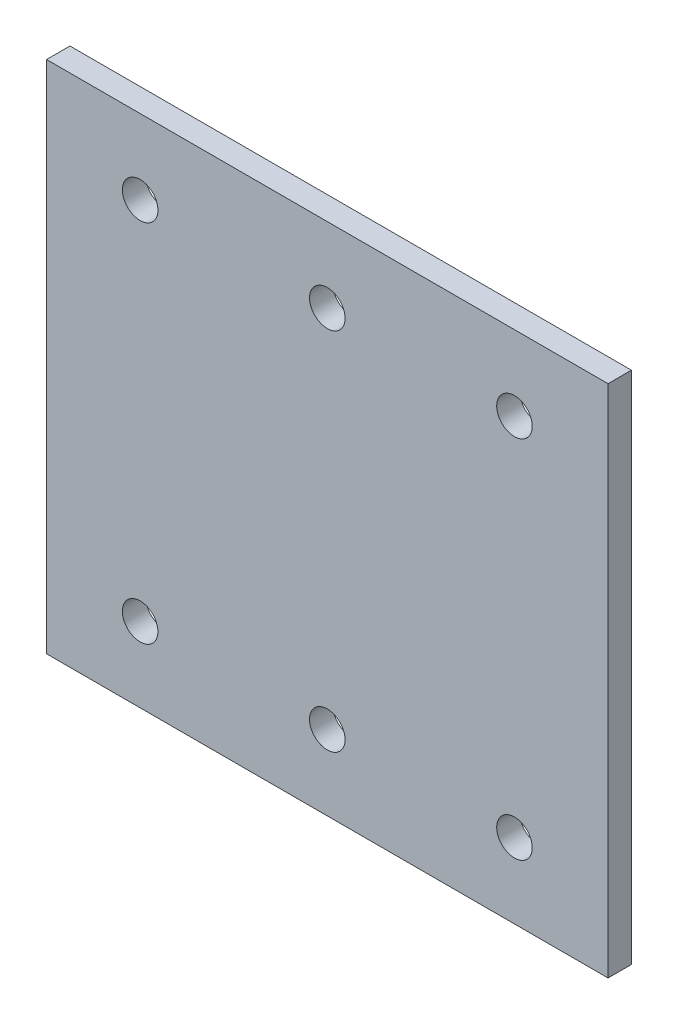
from build123d import *

# Parameters (mm, degrees)
SKETCH1_W           = 76.2
SKETCH1_H           = 69.85
SKETCH1_R           = 2.413
BOSS_EXTRUDE1_DEPTH = 3.175


with BuildPart() as part:
    # Sketch1 → Boss-Extrude1 (new body)
    with BuildSketch(Plane.XY):
        with Locations((38.1, 34.925)):
            Rectangle(SKETCH1_W, SKETCH1_H)
        with Locations((12.7, 59.69)):
            Circle(SKETCH1_R, mode=Mode.SUBTRACT)
        with Locations((38.1, 59.69)):
            Circle(SKETCH1_R, mode=Mode.SUBTRACT)
        with Locations((63.5, 59.69)):
            Circle(SKETCH1_R, mode=Mode.SUBTRACT)
        with Locations(Location((63.5, 10.16, 0), (0, 0, 180))):
            Circle(SKETCH1_R, mode=Mode.SUBTRACT)
        with Locations(Location((38.1, 10.16, 0), (0, 0, 180))):
            Circle(SKETCH1_R, mode=Mode.SUBTRACT)
        with Locations(Location((12.7, 10.16, 0), (0, 0, 180))):
            Circle(SKETCH1_R, mode=Mode.SUBTRACT)
    extrude(amount=BOSS_EXTRUDE1_DEPTH)


solid = part.part
